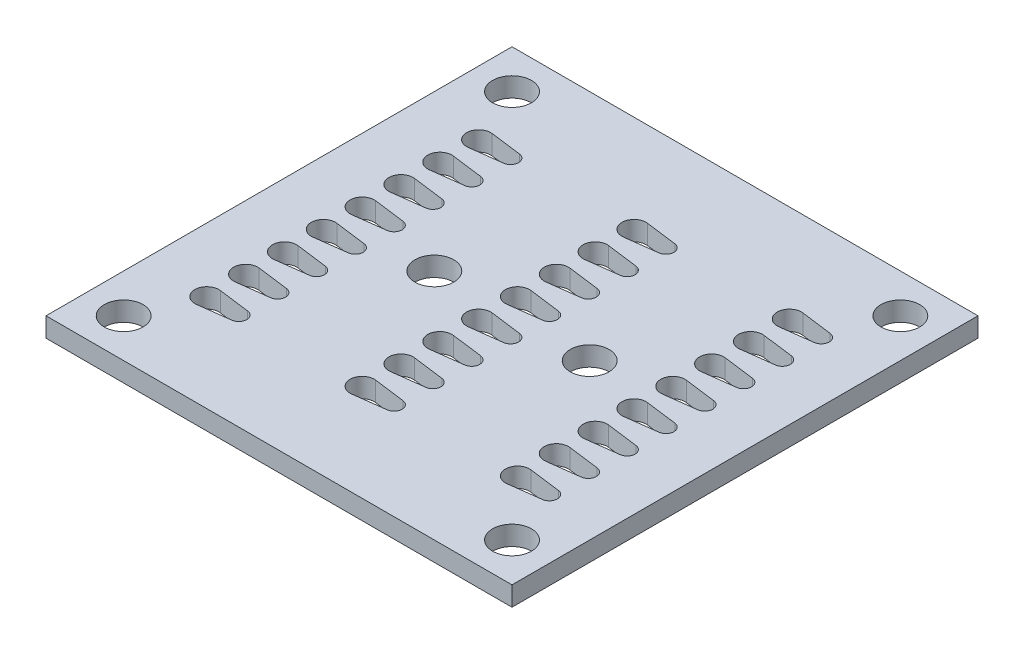
from build123d import *

# Parameters (mm, degrees)
BASEWITH_ALIGNMENT_W = 76.2
BASEWITH_ALIGNMENT_H = 76.2
BASEWITH_ALIGNMENT_R = 3.175
BOSS_EXTRUDE1_DEPTH  = 3.175
CUT_EXTRUDE6_DEPTH   = 88.643803261
LPATTERN1_COUNT      = 8
LPATTERN1_PITCH      = 6.35
LPATTERN1_COUNT_DIR2 = 3
LPATTERN1_PITCH_DIR2 = 25.4


with BuildPart() as part:
    # BaseWith Alignment → Boss-Extrude1 (new body)
    with BuildSketch(Plane(origin=(0, 0, 0), x_dir=(1, 0, 0), z_dir=(0, 1, 0))):
        with Locations((25.4, -22.225)):
            Rectangle(BASEWITH_ALIGNMENT_W, BASEWITH_ALIGNMENT_H)
        with Locations(Location((-6.35, 9.525, 0), (0, 0, 270))):
            Circle(BASEWITH_ALIGNMENT_R, mode=Mode.SUBTRACT)
        with Locations(Location((57.15, 9.525, 0), (0, 0, 270))):
            Circle(BASEWITH_ALIGNMENT_R, mode=Mode.SUBTRACT)
        with Locations(Location((-6.35, -53.975, 0), (0, 0, 270))):
            Circle(BASEWITH_ALIGNMENT_R, mode=Mode.SUBTRACT)
        with Locations(Location((57.15, -53.975, 0), (0, 0, 270))):
            Circle(BASEWITH_ALIGNMENT_R, mode=Mode.SUBTRACT)
        with Locations(Location((12.7, -22.225, 0), (0, 0, 270))):
            Circle(BASEWITH_ALIGNMENT_R, mode=Mode.SUBTRACT)
        with Locations(Location((38.1, -22.225, 0), (0, 0, 270))):
            Circle(BASEWITH_ALIGNMENT_R, mode=Mode.SUBTRACT)
    extrude(amount=BOSS_EXTRUDE1_DEPTH)

    # Sketch1 → Cut-Extrude6 (cut, through all)
    with BuildSketch(Plane(origin=(0, 0, 0), x_dir=(-1, 0, 0), z_dir=(0, -1, 0))):
        with BuildLine():
            Line((2.017857143, -1.961432458), (-3.110714286, -1.296526148))
            ThreePointArc((-3.110714286, -1.296526148), (-4.25, 0), (-3.110714286, 1.296526148))
            Line((-3.110714286, 1.296526148), (2.017857143, 1.961432458))
            ThreePointArc((2.017857143, 1.961432458), (4.25, 0), (2.017857143, -1.961432458))
        make_face()
    cut_extrude6 = extrude(amount=-CUT_EXTRUDE6_DEPTH, mode=Mode.SUBTRACT)

    # LPattern1: Cut-Extrude6 8 × 3
    with Locations(*[(j * LPATTERN1_PITCH_DIR2, 0, i * LPATTERN1_PITCH) for i in range(LPATTERN1_COUNT) for j in range(LPATTERN1_COUNT_DIR2) if (i, j) != (0, 0)]):
        add(cut_extrude6, mode=Mode.SUBTRACT)


solid = part.part
